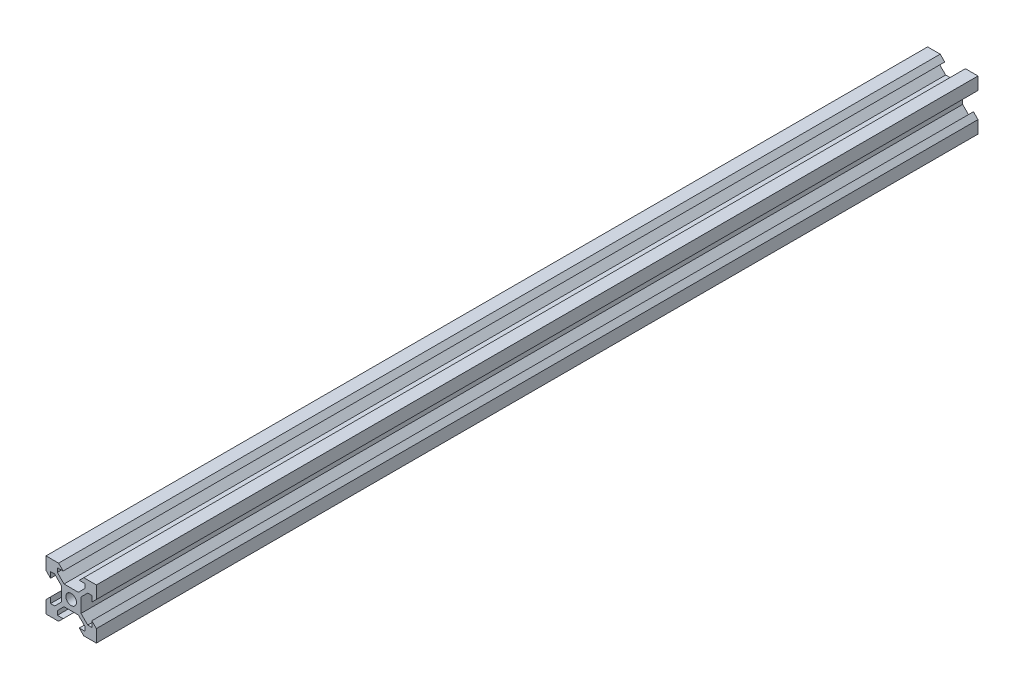
from build123d import *

# Parameters (mm, degrees)
SKETCH1_R           = 2.1
BOSS_EXTRUDE1_DEPTH = 350


with BuildPart() as part:
    # Sketch1 → Boss-Extrude1 (new body)
    with BuildSketch(Plane.XY):
        Polygon((-10, 10), (-10, 5), (-8.2, 3.2), (-8.2, 5.499339828), (-6.56, 5.499339828), (-3.900660172, 2.84), (-3.900660172, -2.84), (-6.56, -5.499339828), (-8.2, -5.499339828), (-8.2, -3.2), (-10, -5), (-10, -10), (-5, -10), (-3.2, -8.2), (-5.499339828, -8.2), (-5.499339828, -6.56), (-2.84, -3.900660172), (2.84, -3.900660172), (5.499339828, -6.56), (5.499339828, -8.2), (3.2, -8.2), (5, -10), (10, -10), (10, -5), (8.2, -3.2), (8.2, -5.499339828), (6.56, -5.499339828), (3.900660172, -2.84), (3.900660172, 2.84), (6.56, 5.499339828), (8.2, 5.499339828), (8.2, 3.2), (10, 5), (10, 10), (5, 10), (3.2, 8.2), (5.499339828, 8.2), (5.499339828, 6.56), (2.84, 3.900660172), (-2.84, 3.900660172), (-5.499339828, 6.56), (-5.499339828, 8.2), (-3.2, 8.2), (-5, 10), align=None)
        Circle(SKETCH1_R, mode=Mode.SUBTRACT)
    extrude(amount=-BOSS_EXTRUDE1_DEPTH)


solid = part.part
